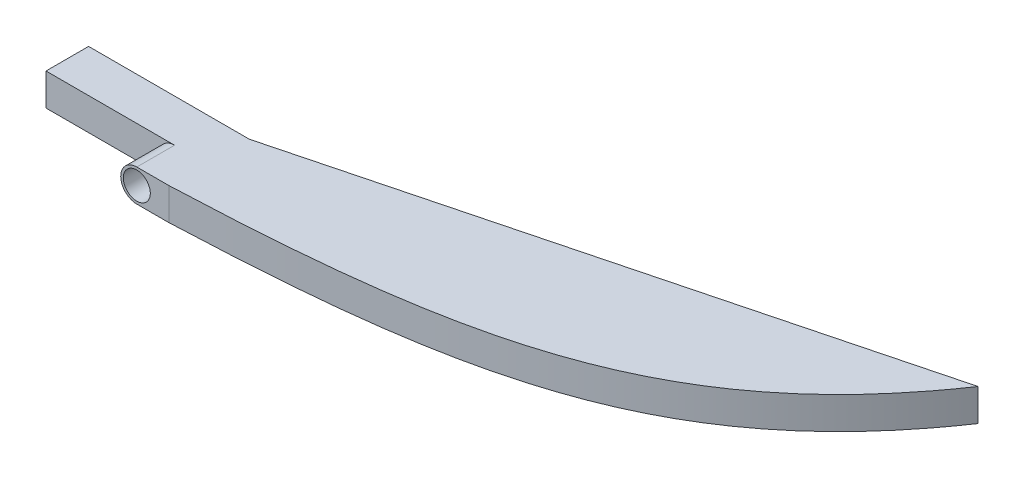
from build123d import *

# Parameters (mm, degrees)
SALIENTE_EXTRUIR1_DEPTH = 5
CROQUIS3_W              = 12.5
CROQUIS3_H              = 5
SALIENTE_EXTRUIR2_DEPTH = 25
CROQUIS4_R              = 2.1
CORTAR_EXTRUIR3_DEPTH   = 12.5
CORTAR_EXTRUIR2_DEPTH   = 5.875


with BuildPart() as part:
    # Croquis2 → Saliente-Extruir1 (new body)
    with BuildSketch(Plane(origin=(0, 0, 0), x_dir=(1, 0, 0), z_dir=(0, 1, 0))):
        with BuildLine():
            Line((0, 0), (0, 12.5))
            Line((0, 12.5), (90, 35.865427318))
            add(Edge.make_bspline(
                [(0, 0), (0.394136999, 0.015797336), (1.194952966, 0.048834045), (2.992448828, 0.125211317), (4.579856068, 0.200911656), (6.612637351, 0.301249971), (8.392251736, 0.398752477), (10.315878033, 0.509903005), (12.159048858, 0.626310038), (14.511736704, 0.785189542), (17.305717547, 0.994336582), (20.114398042, 1.2314722), (22.909905137, 1.499776667), (25.707540494, 1.796493489), (29.430521004, 2.232380684), (34.457318955, 2.928516321), (39.917638309, 3.8880509), (45.326966885, 5.105084916), (49.769918493, 6.319079443), (53.346159155, 7.448006204), (56.870231766, 8.730995456), (60.329622828, 10.180098556), (63.710264837, 11.804910517), (66.997597592, 13.611491814), (70.17732587, 15.601579919), (72.854283587, 17.500893709), (75.067204078, 19.237089159), (76.854732505, 20.752585132), (78.250168573, 22.004629224), (79.619707974, 23.303249768), (80.962355597, 24.647453618), (82.277321506, 26.036087115), (83.403178931, 27.288894321), (84.345387571, 28.382707102), (85.115533062, 29.306902867), (85.722715368, 30.053623655), (86.321025458, 30.807421985), (86.910712224, 31.56828047), (87.491255325, 32.335040025), (88.06431213, 33.109755161), (88.629936117, 33.892108149), (89.099903233, 34.555740193), (89.55695597, 35.215829282), (89.829292977, 35.613909175), (89.943246974, 35.781569234), (90, 35.865427318)],
                knots=[0.074822974, 0.074822974, 0.074822974, 0.074822974, 0.074822974, 0.090398408, 0.105973841, 0.121549274, 0.137124708, 0.152700141, 0.168275574, 0.183851007, 0.199426441, 0.230577307, 0.261728173, 0.277303606, 0.29287904, 0.324029906, 0.386331636, 0.445924571, 0.477075434, 0.508226306, 0.539377159, 0.57052801, 0.601678868, 0.632829681, 0.663980451, 0.695131352, 0.726282194, 0.741857688, 0.757433182, 0.773008671, 0.788584161, 0.804576906, 0.820569651, 0.836562506, 0.844558934, 0.852555362, 0.860551891, 0.86854842, 0.87654495, 0.884541479, 0.89253801, 0.900534541, 0.908531072, 0.912529338, 0.916527603, 0.916527603, 0.916527603, 0.916527603, 0.916527603], degree=4))
        make_face()
    extrude(amount=SALIENTE_EXTRUIR1_DEPTH)

    # Croquis3 → Saliente-Extruir2 (add)
    with BuildSketch(Plane.ZY):
        with Locations((-6.25, 2.5)):
            Rectangle(CROQUIS3_W, CROQUIS3_H)
    extrude(amount=SALIENTE_EXTRUIR2_DEPTH)

    # Croquis4 → Cortar-Extruir3 (cut)
    with BuildSketch(Plane(origin=(0, 0, -12.5), x_dir=(-1, 0, 0), z_dir=(0, 0, -1))):
        with Locations((5, 2.5)):
            Circle(CROQUIS4_R)
    extrude(amount=-CORTAR_EXTRUIR3_DEPTH, mode=Mode.SUBTRACT)

    # Croquis5 → Cortar-Extruir2 (cut)
    with BuildSketch(Plane.XY):
        with BuildLine():
            Line((-16, 5), (-25, 5))
            Line((-25, 5), (-25, 0))
            Line((-25, 0), (-5, 0))
            ThreePointArc((-5, 0), (-7.5, 2.5), (-5, 5))
            Line((-5, 5), (-16, 5))
        make_face()
    extrude(amount=-CORTAR_EXTRUIR2_DEPTH, mode=Mode.SUBTRACT)


solid = part.part
